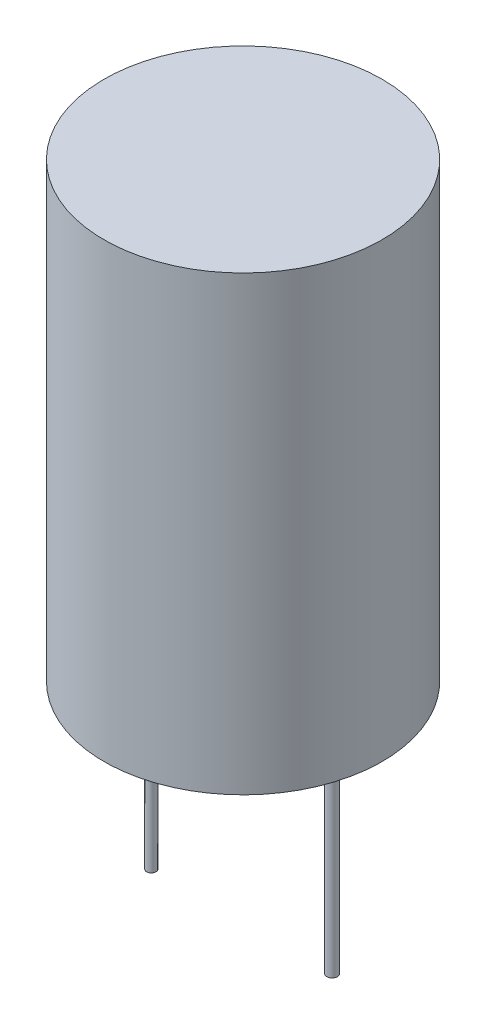
from build123d import *

# Parameters (mm, degrees)
SKETCH1_R           = 4
BOSS_EXTRUDE1_DEPTH = 13
SKETCH2_R           = 0.133652149
SKETCH2_R_2         = 0.154729583
BOSS_EXTRUDE2_DEPTH = 6


with BuildPart() as part:
    # Sketch1 → Boss-Extrude1 (new body)
    with BuildSketch(Plane(origin=(0, 0, 0), x_dir=(1, 0, 0), z_dir=(0, 1, 0))):
        with Locations(Location((0, 0, 0), (0, 0, 90))):
            Circle(SKETCH1_R)
    extrude(amount=BOSS_EXTRUDE1_DEPTH)

    # Sketch2 → Boss-Extrude2 (add)
    with BuildSketch(Plane.XZ):
        with Locations(Location((-2.639629951, 0, 0), (0, 0, 90))):
            Circle(SKETCH2_R)
        with Locations(Location((2.561666197, 0, 0), (0, 0, 90))):
            Circle(SKETCH2_R_2)
    extrude(amount=BOSS_EXTRUDE2_DEPTH)


solid = part.part
